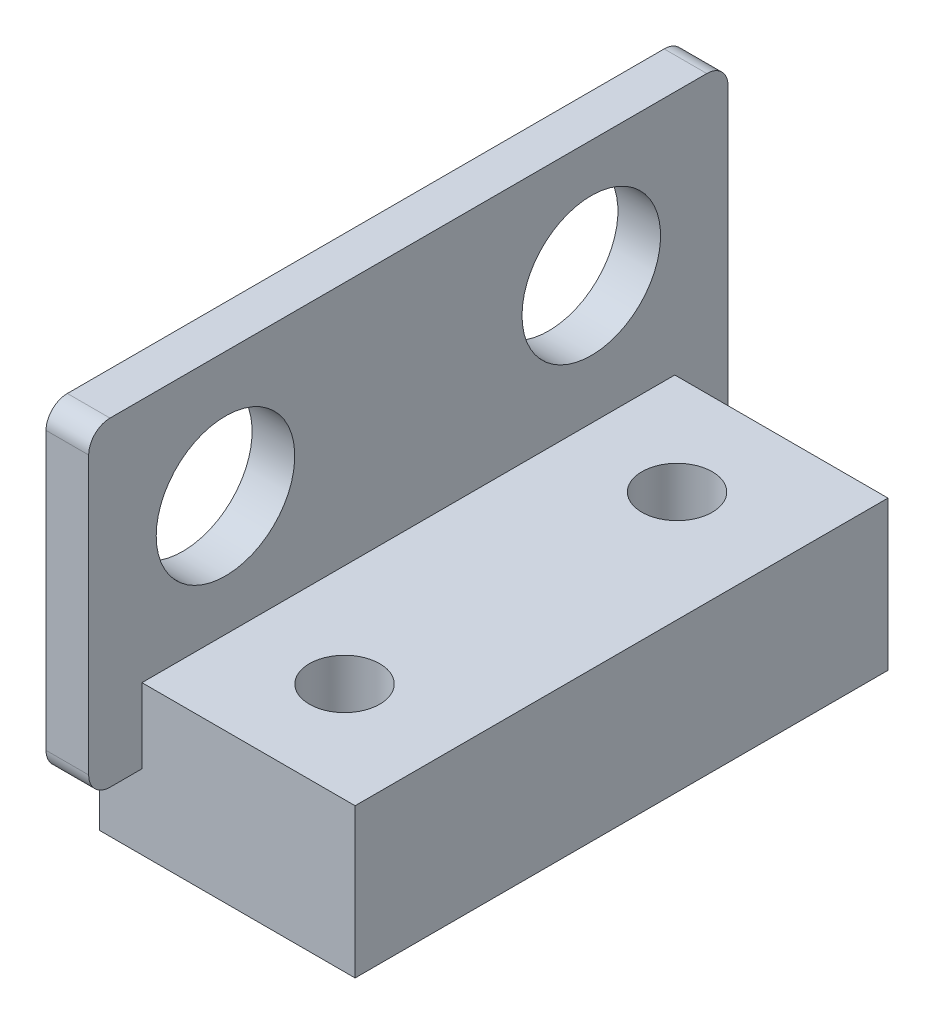
from build123d import *

# Parameters (mm, degrees)
SKETCH1_W           = 12
SKETCH1_H           = 25
SKETCH1_R           = 1.65
BOSS_EXTRUDE1_DEPTH = 3.5
CUT_EXTRUDE1_DEPTH  = 3.5
SKETCH3_R           = 3.25
BOSS_EXTRUDE2_DEPTH = 2


with BuildPart() as part:
    # Sketch1 → Boss-Extrude1 (new, symmetric)
    with BuildSketch(Plane(origin=(0, 0, 0), x_dir=(1, 0, 0), z_dir=(0, 1, 0))):
        Rectangle(SKETCH1_W, SKETCH1_H)
        with Locations(Location((0.804958277, -7.8, 0), (0, 0, 270))):
            Circle(SKETCH1_R, mode=Mode.SUBTRACT)
        with Locations(Location((0.804958277, 7.8, 0), (0, 0, 90))):
            Circle(SKETCH1_R, mode=Mode.SUBTRACT)
    extrude(amount=BOSS_EXTRUDE1_DEPTH, both=True)

    # Sketch2 → Cut-Extrude1 (cut)
    with BuildSketch(Plane.XZ.offset(3.5)):
        Polygon((2.652479139, 4.6), (4.5, 7.8), (2.652479139, 11), (-1.042562584, 11), (-2.890083446, 7.8), (-1.042562584, 4.6), align=None)
        Polygon((2.652479139, -11), (4.5, -7.8), (2.652479139, -4.6), (-1.042562584, -4.6), (-2.890083446, -7.8), (-1.042562584, -11), align=None)
    extrude(amount=-CUT_EXTRUDE1_DEPTH, mode=Mode.SUBTRACT)

    # Sketch3 → Boss-Extrude2 (add)
    with BuildSketch(Plane.ZY.offset(6)):
        with BuildLine():
            Line((0, 0), (14, 0))
            ThreePointArc((14, 0), (14.707106781, 0.292893219), (15, 1))
            Line((15, 1), (15, 14))
            ThreePointArc((15, 14), (14.707106781, 14.707106781), (14, 15))
            Line((14, 15), (-14, 15))
            ThreePointArc((-14, 15), (-14.707106781, 14.707106781), (-15, 14))
            Line((-15, 14), (-15, 1))
            ThreePointArc((-15, 1), (-14.707106781, 0.292893219), (-14, 0))
            Line((-14, 0), (0, 0))
        make_face()
        with Locations((-8.581197846, 9.5)):
            Circle(SKETCH3_R, mode=Mode.SUBTRACT)
        with Locations((8.581197846, 9.124939365)):
            Circle(SKETCH3_R, mode=Mode.SUBTRACT)
    extrude(amount=-BOSS_EXTRUDE2_DEPTH)


solid = part.part
